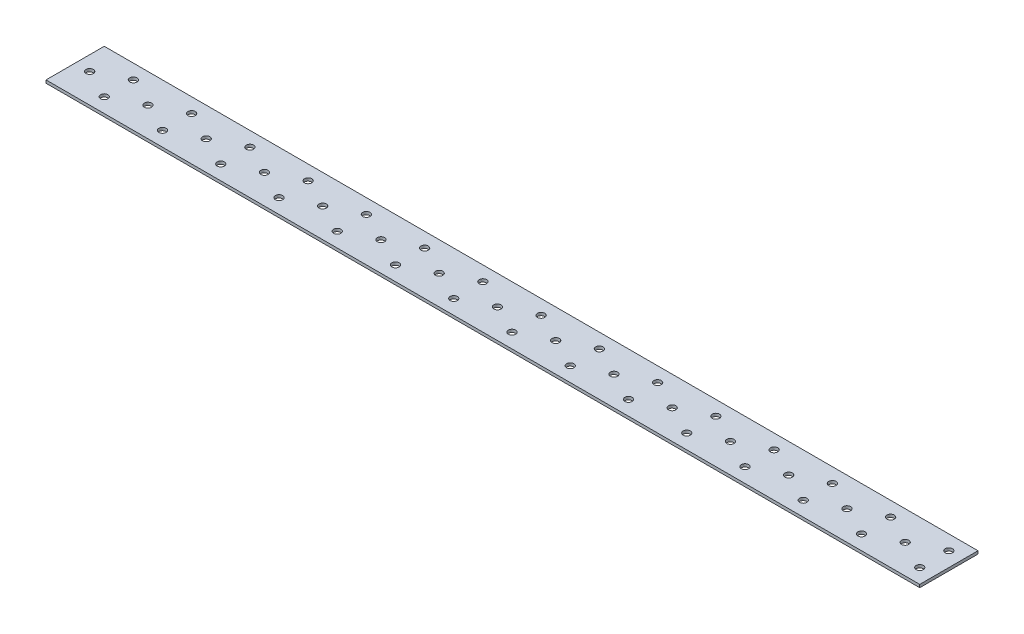
from build123d import *

# Parameters (mm, degrees)
SKETCH_1_W      = 600
SKETCH_1_H      = 40
SKETCH_1_R      = 2.5
EXTRUDE_1_DEPTH = 2


with BuildPart() as part:
    # Эскиз1 → Бобышка-Вытянуть1 (new body)
    with BuildSketch(Plane(origin=(0, 0, 0), x_dir=(1, 0, 0), z_dir=(0, 1, 0))):
        Rectangle(SKETCH_1_W, SKETCH_1_H)
        with Locations(Location((-290, 0, 0), (0, 0, 270))):
            Circle(SKETCH_1_R, mode=Mode.SUBTRACT)
        with Locations(Location((-270, 10, 0), (0, 0, 270))):
            Circle(SKETCH_1_R, mode=Mode.SUBTRACT)
        with Locations(Location((-270, -10, 0), (0, 0, 270))):
            Circle(SKETCH_1_R, mode=Mode.SUBTRACT)
        with Locations(Location((-230, 10, 0), (0, 0, 270))):
            Circle(SKETCH_1_R, mode=Mode.SUBTRACT)
        with Locations(Location((-230, -10, 0), (0, 0, 270))):
            Circle(SKETCH_1_R, mode=Mode.SUBTRACT)
        with Locations(Location((-250, 0, 0), (0, 0, 270))):
            Circle(SKETCH_1_R, mode=Mode.SUBTRACT)
        with Locations(Location((-190, 10, 0), (0, 0, 270))):
            Circle(SKETCH_1_R, mode=Mode.SUBTRACT)
        with Locations(Location((-190, -10, 0), (0, 0, 270))):
            Circle(SKETCH_1_R, mode=Mode.SUBTRACT)
        with Locations(Location((-210, 0, 0), (0, 0, 270))):
            Circle(SKETCH_1_R, mode=Mode.SUBTRACT)
        with Locations(Location((-150, 10, 0), (0, 0, 270))):
            Circle(SKETCH_1_R, mode=Mode.SUBTRACT)
        with Locations(Location((-150, -10, 0), (0, 0, 270))):
            Circle(SKETCH_1_R, mode=Mode.SUBTRACT)
        with Locations(Location((-170, 0, 0), (0, 0, 270))):
            Circle(SKETCH_1_R, mode=Mode.SUBTRACT)
        with Locations(Location((-110, 10, 0), (0, 0, 270))):
            Circle(SKETCH_1_R, mode=Mode.SUBTRACT)
        with Locations(Location((-110, -10, 0), (0, 0, 270))):
            Circle(SKETCH_1_R, mode=Mode.SUBTRACT)
        with Locations(Location((-130, 0, 0), (0, 0, 270))):
            Circle(SKETCH_1_R, mode=Mode.SUBTRACT)
        with Locations(Location((-70, 10, 0), (0, 0, 270))):
            Circle(SKETCH_1_R, mode=Mode.SUBTRACT)
        with Locations(Location((-70, -10, 0), (0, 0, 270))):
            Circle(SKETCH_1_R, mode=Mode.SUBTRACT)
        with Locations(Location((-90, 0, 0), (0, 0, 270))):
            Circle(SKETCH_1_R, mode=Mode.SUBTRACT)
        with Locations(Location((-30, 10, 0), (0, 0, 270))):
            Circle(SKETCH_1_R, mode=Mode.SUBTRACT)
        with Locations(Location((-30, -10, 0), (0, 0, 270))):
            Circle(SKETCH_1_R, mode=Mode.SUBTRACT)
        with Locations(Location((-50, 0, 0), (0, 0, 270))):
            Circle(SKETCH_1_R, mode=Mode.SUBTRACT)
        with Locations(Location((10, 10, 0), (0, 0, 270))):
            Circle(SKETCH_1_R, mode=Mode.SUBTRACT)
        with Locations(Location((10, -10, 0), (0, 0, 270))):
            Circle(SKETCH_1_R, mode=Mode.SUBTRACT)
        with Locations(Location((-10, 0, 0), (0, 0, 270))):
            Circle(SKETCH_1_R, mode=Mode.SUBTRACT)
        with Locations(Location((50, 10, 0), (0, 0, 270))):
            Circle(SKETCH_1_R, mode=Mode.SUBTRACT)
        with Locations(Location((50, -10, 0), (0, 0, 270))):
            Circle(SKETCH_1_R, mode=Mode.SUBTRACT)
        with Locations(Location((30, 0, 0), (0, 0, 270))):
            Circle(SKETCH_1_R, mode=Mode.SUBTRACT)
        with Locations(Location((90, 10, 0), (0, 0, 270))):
            Circle(SKETCH_1_R, mode=Mode.SUBTRACT)
        with Locations(Location((90, -10, 0), (0, 0, 270))):
            Circle(SKETCH_1_R, mode=Mode.SUBTRACT)
        with Locations(Location((70, 0, 0), (0, 0, 270))):
            Circle(SKETCH_1_R, mode=Mode.SUBTRACT)
        with Locations(Location((130, 10, 0), (0, 0, 270))):
            Circle(SKETCH_1_R, mode=Mode.SUBTRACT)
        with Locations(Location((130, -10, 0), (0, 0, 270))):
            Circle(SKETCH_1_R, mode=Mode.SUBTRACT)
        with Locations(Location((110, 0, 0), (0, 0, 270))):
            Circle(SKETCH_1_R, mode=Mode.SUBTRACT)
        with Locations(Location((170, 10, 0), (0, 0, 270))):
            Circle(SKETCH_1_R, mode=Mode.SUBTRACT)
        with Locations(Location((170, -10, 0), (0, 0, 270))):
            Circle(SKETCH_1_R, mode=Mode.SUBTRACT)
        with Locations(Location((150, 0, 0), (0, 0, 270))):
            Circle(SKETCH_1_R, mode=Mode.SUBTRACT)
        with Locations(Location((210, 10, 0), (0, 0, 270))):
            Circle(SKETCH_1_R, mode=Mode.SUBTRACT)
        with Locations(Location((210, -10, 0), (0, 0, 270))):
            Circle(SKETCH_1_R, mode=Mode.SUBTRACT)
        with Locations(Location((190, 0, 0), (0, 0, 270))):
            Circle(SKETCH_1_R, mode=Mode.SUBTRACT)
        with Locations(Location((250, 10, 0), (0, 0, 270))):
            Circle(SKETCH_1_R, mode=Mode.SUBTRACT)
        with Locations(Location((250, -10, 0), (0, 0, 270))):
            Circle(SKETCH_1_R, mode=Mode.SUBTRACT)
        with Locations(Location((230, 0, 0), (0, 0, 270))):
            Circle(SKETCH_1_R, mode=Mode.SUBTRACT)
        with Locations(Location((290, 10, 0), (0, 0, 270))):
            Circle(SKETCH_1_R, mode=Mode.SUBTRACT)
        with Locations(Location((290, -10, 0), (0, 0, 270))):
            Circle(SKETCH_1_R, mode=Mode.SUBTRACT)
        with Locations(Location((270, 0, 0), (0, 0, 270))):
            Circle(SKETCH_1_R, mode=Mode.SUBTRACT)
    extrude(amount=EXTRUDE_1_DEPTH)


solid = part.part
